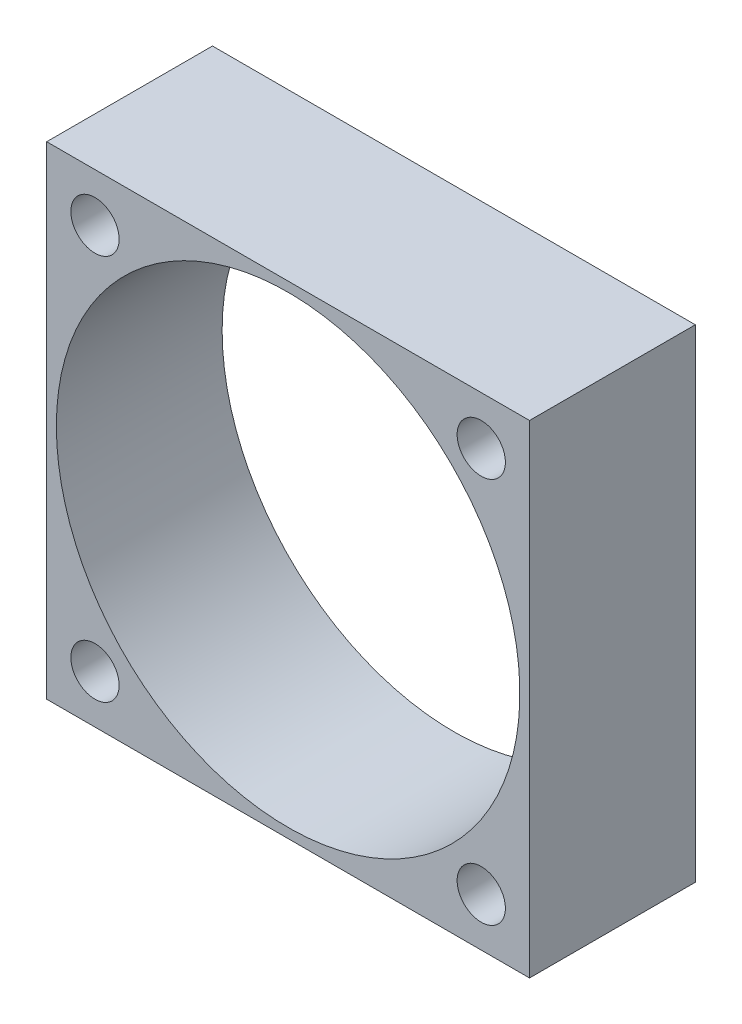
from build123d import *

# Parameters (mm, degrees)
SKETCH_1_W      = 30
SKETCH_1_H      = 30
SKETCH_1_R      = 14.4
SKETCH_1_R_2    = 1.5
EXTRUDE_1_DEPTH = 10.3


with BuildPart() as part:
    # 草图1 → 凸台-拉伸1 (new body)
    with BuildSketch(Plane.XY):
        Rectangle(SKETCH_1_W, SKETCH_1_H)
        with Locations(Location((0, 0, 0), (0, 0, 180))):
            Circle(SKETCH_1_R, mode=Mode.SUBTRACT)
        with Locations(Location((-12, 12, 0), (0, 0, 180))):
            Circle(SKETCH_1_R_2, mode=Mode.SUBTRACT)
        with Locations(Location((12, 12, 0), (0, 0, 180))):
            Circle(SKETCH_1_R_2, mode=Mode.SUBTRACT)
        with Locations(Location((12, -12, 0), (0, 0, 180))):
            Circle(SKETCH_1_R_2, mode=Mode.SUBTRACT)
        with Locations(Location((-12, -12, 0), (0, 0, 180))):
            Circle(SKETCH_1_R_2, mode=Mode.SUBTRACT)
    extrude(amount=EXTRUDE_1_DEPTH)


solid = part.part
